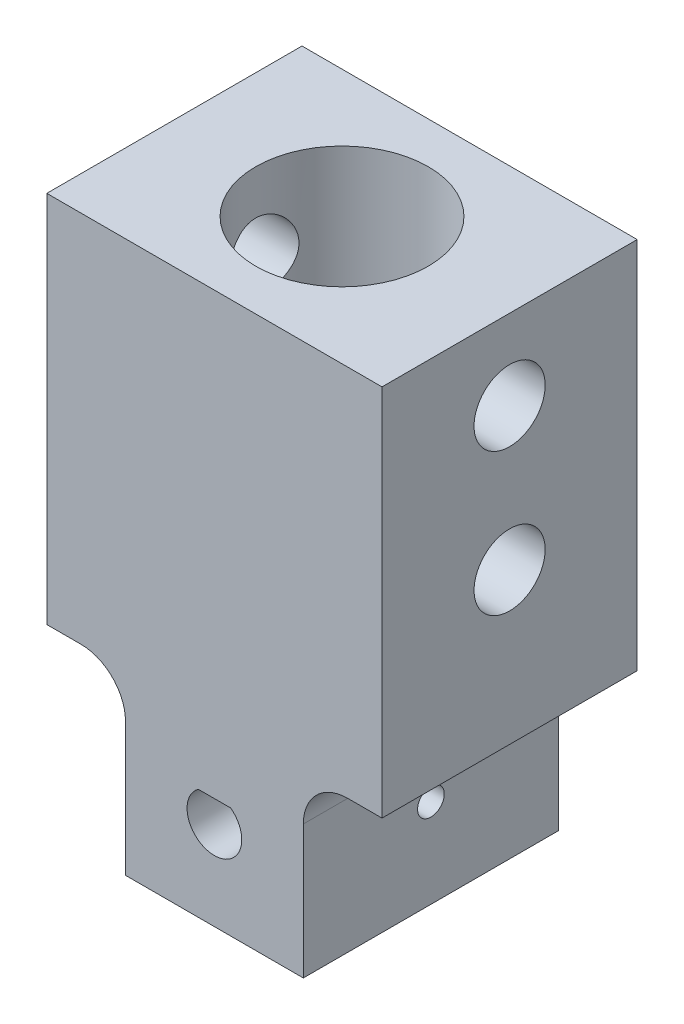
from build123d import *

# Parameters (mm, degrees)
SKETCH11_W              = 37.7
SKETCH11_H              = 28.7
SKETCH11_R              = 9.7
BOSS_EXTRUDE1_DEPTH     = 42
BOSS_EXTRUDE3_REACH     = 56.25
SKETCH15_W              = 37.7
SKETCH15_H              = 5
SKETCH12_R              = 4
CUT_EXTRUDE1_DEPTH      = 40
SKETCH23_W              = 20
SKETCH23_H              = 20
BOSS_EXTRUDE4_DEPTH     = 14.35
CUT_EXTRUDE2_DEPTH      = 49.220794396
CUT_EXTRUDE2_DEPTH_BACK = 49.220794396
SKETCH24_R              = 1.5
FILLET1_R               = 5


with BuildPart() as part:
    # Sketch11 → Boss-Extrude1 (new body)
    with BuildSketch(Plane(origin=(0, 0, 0), x_dir=(1, 0, 0), z_dir=(0, 1, 0))):
        Rectangle(SKETCH11_W, SKETCH11_H)
        with Locations(Location((0, 0, 0), (0, 0, 90))):
            Circle(SKETCH11_R, mode=Mode.SUBTRACT)
    extrude(amount=BOSS_EXTRUDE1_DEPTH)

    # Boss-Extrude3: up to this face of the body (flat: up to its plane)
    boss_extrude3_end = Plane(part.part.faces().sort_by_distance((0, 21, -14.35))[0])
    # Sketch15 → Boss-Extrude3 (add, up to the picked face)
    with BuildSketch(Plane.XY.offset(14.35), mode=Mode.PRIVATE) as boss_extrude3_sk1:
        with Locations((0, 2.5)):
            Rectangle(SKETCH15_W, SKETCH15_H)
    boss_extrude3_tool1 = split(extrude(boss_extrude3_sk1.sketch, amount=-BOSS_EXTRUDE3_REACH, mode=Mode.PRIVATE), bisect_by=boss_extrude3_end, keep=Keep.BOTH, mode=Mode.PRIVATE)
    add(boss_extrude3_tool1.solids().sort_by(Axis((0, 2.5, 14.35), (0, 0, -1)))[0])

    # Sketch12 → Cut-Extrude1 (cut)
    with BuildSketch(Plane(origin=(18.85, 0, 0), x_dir=(0, 0, -1), z_dir=(1, 0, 0))):
        with Locations((0, 33)):
            Circle(SKETCH12_R)
        with Locations((0, 17)):
            Circle(SKETCH12_R)
    extrude(amount=-CUT_EXTRUDE1_DEPTH, mode=Mode.SUBTRACT)

    # Sketch23 → Boss-Extrude4 (add, symmetric)
    with BuildSketch(Plane.XY):
        with Locations((0, -10)):
            Rectangle(SKETCH23_W, SKETCH23_H)
        with BuildLine():
            Line((-1.824828759, -7.525), (1.824828759, -7.525))
            ThreePointArc((1.824828759, -7.525), (0, -13.075), (-1.824828759, -7.525))
        make_face(mode=Mode.SUBTRACT)
    extrude(amount=BOSS_EXTRUDE4_DEPTH, both=True)

    # Sketch24 → Cut-Extrude2 (cut, two sides: drawn at the far end of the back side and taken through both)
    with BuildSketch(Plane(origin=(0, 0, 0), x_dir=(0, 0, -1), z_dir=(1, 0, 0)).offset(-CUT_EXTRUDE2_DEPTH_BACK)):
        with Locations((0, -10)):
            Circle(SKETCH24_R)
    extrude(amount=CUT_EXTRUDE2_DEPTH + CUT_EXTRUDE2_DEPTH_BACK, mode=Mode.SUBTRACT)

    # Fillet1
    fillet1_edges = [part.edges().sort_by_distance(p)[0] for p in [
        (10, 0, 0),
        (-10, 0, 0),
    ]]
    fillet(fillet1_edges, radius=FILLET1_R)


solid = part.part
